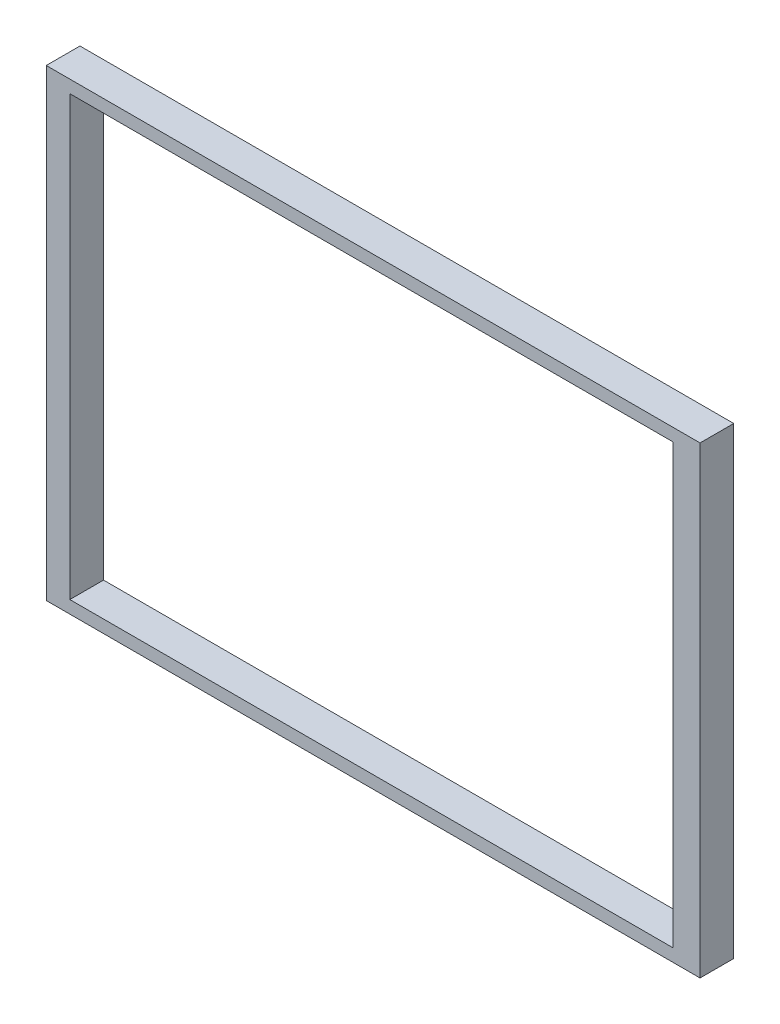
from build123d import *

# Parameters (mm, degrees)
SKIZZE1_W                       = 77.6
SKIZZE1_H                       = 55
SKIZZE1_W_2                     = 71.6
SKIZZE1_H_2                     = 52
AUFSATZ_LINEAR_AUSTRAGEN1_DEPTH = 4


with BuildPart() as part:
    # Skizze1 → Aufsatz-Linear austragen1 (new body)
    with BuildSketch(Plane.XY):
        with Locations((1.044006052, 4.309701493)):
            Rectangle(SKIZZE1_W, SKIZZE1_H)
        with Locations((0.844006052, 4.309701493)):
            Rectangle(SKIZZE1_W_2, SKIZZE1_H_2, mode=Mode.SUBTRACT)
    extrude(amount=AUFSATZ_LINEAR_AUSTRAGEN1_DEPTH)


solid = part.part
